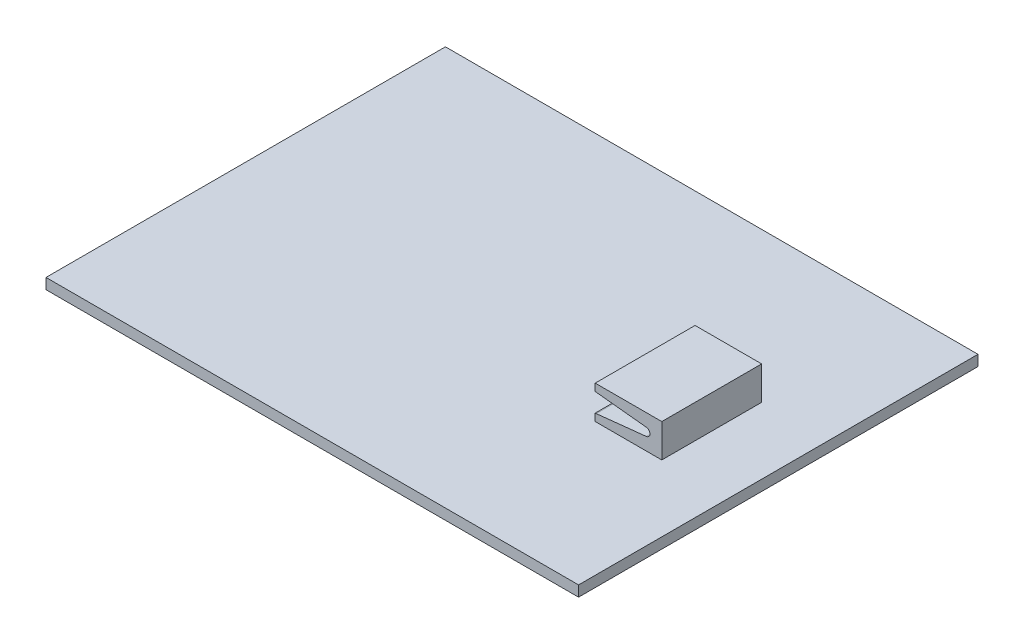
from build123d import *

# Parameters (mm, degrees)
SKETCH1_W               = 800
SKETCH1_H               = 600
BOSS_EXTRUDE1_DEPTH     = 16
SKETCH2_W               = 100
SKETCH2_H               = 150
BOSS_EXTRUDE2_DEPTH     = 50
CUT_EXTRUDE1_DEPTH      = 553.2508488
CUT_EXTRUDE1_DEPTH_BACK = 553.2508488


with BuildPart() as part:
    # Sketch1 → Boss-Extrude1 (new body)
    with BuildSketch(Plane(origin=(0, 0, 0), x_dir=(1, 0, 0), z_dir=(0, 1, 0))):
        Rectangle(SKETCH1_W, SKETCH1_H)
    extrude(amount=BOSS_EXTRUDE1_DEPTH)

    # Sketch2 → Boss-Extrude2 (add)
    with BuildSketch(Plane(origin=(0, 16, 0), x_dir=(1, 0, 0), z_dir=(0, 1, 0))):
        with Locations((250, 0)):
            Rectangle(SKETCH2_W, SKETCH2_H)
    extrude(amount=BOSS_EXTRUDE2_DEPTH)

    # Sketch3 → Cut-Extrude1 (cut, two sides: drawn at the far end of the back side and taken through both)
    with BuildSketch(Plane(origin=(0, 0, -75), x_dir=(-1, 0, 0), z_dir=(0, 0, -1)).offset(-CUT_EXTRUDE1_DEPTH_BACK)):
        with BuildLine():
            Line((-276.86296919, 46.966870707), (-201.469173784, 54.922698316))
            ThreePointArc((-201.469173784, 54.922698316), (-186, 41), (-201.469173784, 27.077301684))
            Line((-201.469173784, 27.077301684), (-276.86296919, 35.033129293))
            ThreePointArc((-276.86296919, 35.033129293), (-282.233323283, 41), (-276.86296919, 46.966870707))
        make_face()
    extrude(amount=CUT_EXTRUDE1_DEPTH + CUT_EXTRUDE1_DEPTH_BACK, mode=Mode.SUBTRACT)


solid = part.part
